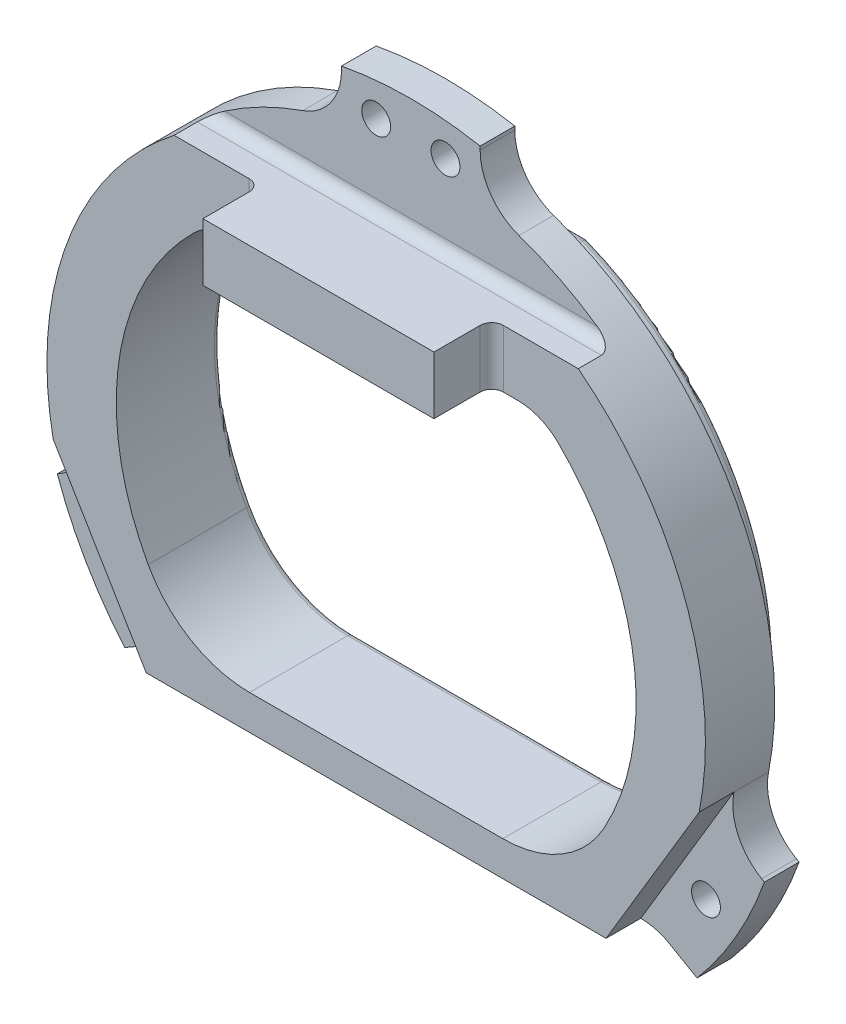
from build123d import *

# Parameters (mm, degrees)
BASE_EXTRUDE_DEPTH                             = 3
BASE_START                                     = -3
BASE_CENTER_FILL_DEPTH                         = 3
HYDRA_CRADDLE_INSERT_DEPTH                     = 3
WEIGHT_RELIEF_DEPTH                            = 46.043730576
WEIGHT_RELIEF_DEPTH_BACK                       = 46.043730576
SKETCH6_R                                      = 1.25
SCREWHOLES_TO_HYDRA_CRADDLE_DEPTH              = 10
FILLET1_R                                      = 10
FILLET2_R                                      = 5
SPACER_BETWEEN_HYDRA_STACK_AND_E_MATCH_C_DEPTH = 3
EMATCH_WIRE_CLEARANCE_CUT_DEPTH                = 46.540505752
EMATCH_WIRE_CLEARANCE_CUT_DEPTH_BACK           = 3
SKETCH9_W                                      = 20
SKETCH9_H                                      = 5
ALIGNMENT_PEG_WITH_BLAST_SHIELD_DEPTH          = 5
FILLET3_R                                      = 1
FILLET4_R                                      = 0.5


with BuildPart() as part:
    # Sketch1 → BASE EXTRUDE (new body)
    with BuildSketch(Plane.XY.offset(25)):
        with BuildLine():
            Line((0, 19.861263432), (6, 19.861263432))
            Line((6, 19.861263432), (6, 24))
            ThreePointArc((6, 24), (6.4, 24.8), (7.28, 24.96))
            ThreePointArc((7.28, 24.96), (25.292757683, 6.022990019), (17.748239349, -19))
            Line((17.748239349, -19), (19.902899824, -19))
            ThreePointArc((19.902899824, -19), (21.19699505, -19.170370869), (22.402899824, -19.669872981))
            Line((22.402899824, -19.669872981), (24.772193743, -21.037785463))
            ThreePointArc((24.772193743, -21.037785463), (28.145825623, -16.25), (30.605353521, -10.934456357))
            Line((30.605353521, -10.934456357), (30.369621377, -10.79835634))
            ThreePointArc((30.369621377, -10.79835634), (28.317417482, -8.536426532), (27.963707738, -5.50282196))
            ThreePointArc((27.963707738, -5.50282196), (24.719171834, 14.184940742), (9.358208955, 26.919768297))
            ThreePointArc((9.358208955, 26.919768297), (6.925140786, 28.74503188), (6, 31.642534665))
            Line((6, 31.642534665), (6, 31.941352507))
            ThreePointArc((6, 31.941352507), (3.012975565, 32.360036747), (0, 32.5))
            ThreePointArc((0, 32.5), (-3.012975565, 32.360036747), (-6, 31.941352507))
            Line((-6, 31.941352507), (-6, 31.642534665))
            ThreePointArc((-6, 31.642534665), (-6.925140786, 28.74503188), (-9.358208955, 26.919768297))
            ThreePointArc((-9.358208955, 26.919768297), (-24.719171834, 14.184940742), (-27.963707738, -5.50282196))
            ThreePointArc((-27.963707738, -5.50282196), (-28.317417482, -8.536426532), (-30.369621377, -10.79835634))
            Line((-30.369621377, -10.79835634), (-30.605353521, -10.934456357))
            ThreePointArc((-30.605353521, -10.934456357), (-28.145825623, -16.25), (-24.772193743, -21.037785463))
            Line((-24.772193743, -21.037785463), (-22.402899824, -19.669872981))
            ThreePointArc((-22.402899824, -19.669872981), (-21.19699505, -19.170370869), (-19.902899824, -19))
            Line((-19.902899824, -19), (-17.748239349, -19))
            ThreePointArc((-17.748239349, -19), (-25.292757683, 6.022990019), (-7.28, 24.96))
            ThreePointArc((-7.28, 24.96), (-6.4, 24.8), (-6, 24))
            Line((-6, 24), (-6, 19.861263432))
            Line((-6, 19.861263432), (0, 19.861263432))
        make_face()
    extrude(amount=BASE_EXTRUDE_DEPTH)

    # Sketch3 → BASE CENTER FILL (add)
    with BuildSketch(Plane.XY.offset(28).offset(BASE_START)):
        with BuildLine():
            Line((-17.748239349, -19), (17.748239349, -19))
            ThreePointArc((17.748239349, -19), (0, 26), (-17.748239349, -19))
        make_face()
    extrude(amount=BASE_CENTER_FILL_DEPTH)

    # Sketch4 → HYDRA CRADDLE INSERT (add)
    with BuildSketch(Plane(origin=(0, 0, 25), x_dir=(-1, 0, 0), z_dir=(0, 0, -1))):
        with BuildLine():
            Line((-6.25, 23.763154252), (-9.25, 23.763154252))
            ThreePointArc((-9.25, 23.763154252), (-25.090515447, 4.551487076), (-17.007351352, -19))
            Line((-17.007351352, -19), (17.007351352, -19))
            ThreePointArc((17.007351352, -19), (25.090515447, 4.551487076), (9.25, 23.763154252))
            Line((9.25, 23.763154252), (6.25, 23.763154252))
            Line((6.25, 23.763154252), (6.25, 19.5))
            Line((6.25, 19.5), (-6.25, 19.5))
            Line((-6.25, 19.5), (-6.25, 23.763154252))
        make_face()
    extrude(amount=HYDRA_CRADDLE_INSERT_DEPTH)

    # Sketch5 → WEIGHT RELIEF (cut, two sides: drawn at the far end of the back side and taken through both)
    with BuildSketch(Plane(origin=(0, 0, 22), x_dir=(-1, 0, 0), z_dir=(0, 0, -1)).offset(-WEIGHT_RELIEF_DEPTH_BACK)):
        with BuildLine():
            Line((-14.142135624, 17.5), (14.142135624, 17.5))
            ThreePointArc((14.142135624, 17.5), (22.471855433, 1.125039286), (15.81929202, -16))
            Line((15.81929202, -16), (-15.81929202, -16))
            ThreePointArc((-15.81929202, -16), (-22.471855433, 1.125039286), (-14.142135624, 17.5))
        make_face()
    extrude(amount=WEIGHT_RELIEF_DEPTH + WEIGHT_RELIEF_DEPTH_BACK, mode=Mode.SUBTRACT)

    # Sketch6 → SCREWHOLES TO HYDRA CRADDLE (cut)
    with BuildSketch(Plane(origin=(0, 0, 25), x_dir=(-1, 0, 0), z_dir=(0, 0, -1))):
        with Locations((-25.547749412, -14.75)):
            Circle(SKETCH6_R)
        with Locations((25.547749412, -14.75)):
            Circle(SKETCH6_R)
        with Locations((-3, 29.5)):
            Circle(SKETCH6_R)
        with Locations((3, 29.5)):
            Circle(SKETCH6_R)
    extrude(amount=-SCREWHOLES_TO_HYDRA_CRADDLE_DEPTH, mode=Mode.SUBTRACT)

    # Fillet1
    fillet1_edges = [part.edges().sort_by_distance(p)[0] for p in [
        (15.81929202, -16, 25),
        (-15.81929202, -16, 25),
    ]]
    fillet(fillet1_edges, radius=FILLET1_R)

    # Fillet2
    fillet2_edges = [part.edges().sort_by_distance(p)[0] for p in [
        (14.142135624, 17.5, 25),
        (-14.142135624, 17.5, 25),
    ]]
    fillet(fillet2_edges, radius=FILLET2_R)

    # Sketch7 → SPACER BETWEEN HYDRA STACK AND E-MATCH CRADDLES (add)
    with BuildSketch(Plane.XY.offset(28)):
        with BuildLine():
            Line((-9.358208955, 26.919768297), (9.358208955, 26.919768297))
            ThreePointArc((9.358208955, 26.919768297), (24.719171834, 14.184940742), (27.963707738, -5.50282196))
            Line((27.963707738, -5.50282196), (19.902899824, -19))
            Line((19.902899824, -19), (-19.902899824, -19))
            Line((-19.902899824, -19), (-27.963707738, -5.50282196))
            ThreePointArc((-27.963707738, -5.50282196), (-24.719171834, 14.184940742), (-9.358208955, 26.919768297))
        make_face()
        with BuildLine():
            Line((10.9658561, -16), (-10.9658561, -16))
            ThreePointArc((-10.9658561, -16), (-16.064875613, -14.602325267), (-19.73854098, -10.8))
            ThreePointArc((-19.73854098, -10.8), (-22.255771186, 3.306153192), (-15.746719775, 16.071428571))
            ThreePointArc((-15.746719775, 16.071428571), (-14.137271079, 17.129100499), (-12.247448714, 17.5))
            Line((-12.247448714, 17.5), (12.247448714, 17.5))
            ThreePointArc((12.247448714, 17.5), (14.137271079, 17.129100499), (15.746719775, 16.071428571))
            ThreePointArc((15.746719775, 16.071428571), (22.255771186, 3.306153192), (19.73854098, -10.8))
            ThreePointArc((19.73854098, -10.8), (16.064875613, -14.602325267), (10.9658561, -16))
        make_face(mode=Mode.SUBTRACT)
    extrude(amount=SPACER_BETWEEN_HYDRA_STACK_AND_E_MATCH_C_DEPTH)

    # Sketch8 → EMATCH WIRE CLEARANCE CUT (cut, two sides: drawn at the far end of the back side and taken through both)
    with BuildSketch(Plane.XY.offset(31).offset(-EMATCH_WIRE_CLEARANCE_CUT_DEPTH_BACK)):
        with BuildLine():
            Line((-17.492855685, 22.5), (17.492855685, 22.5))
            ThreePointArc((17.492855685, 22.5), (13.606193664, 25.042393935), (9.358208955, 26.919768297))
            Line((9.358208955, 26.919768297), (-9.358208955, 26.919768297))
            ThreePointArc((-9.358208955, 26.919768297), (-13.606193664, 25.042393935), (-17.492855685, 22.5))
        make_face()
    extrude(amount=EMATCH_WIRE_CLEARANCE_CUT_DEPTH + EMATCH_WIRE_CLEARANCE_CUT_DEPTH_BACK, mode=Mode.SUBTRACT)

    # Sketch9 → ALIGNMENT PEG WITH BLAST SHIELD (add)
    with BuildSketch(Plane.XY.offset(31)):
        with Locations((0, 20)):
            Rectangle(SKETCH9_W, SKETCH9_H)
    extrude(amount=ALIGNMENT_PEG_WITH_BLAST_SHIELD_DEPTH)

    # Fillet3
    fillet3_edges = [part.edges().sort_by_distance(p)[0] for p in [
        (0, 22.5, 28),
        (-10, 20, 31),
        (10, 20, 31),
    ]]
    fillet(fillet3_edges, radius=FILLET3_R)

    # Fillet4
    fillet4_edges = [part.edges().sort_by_distance(p)[0] for p in [
        (7.75, 23.763154252, 22),
        (6.25, 23.763154252, 23.5),
        (25.090515447, 4.551487076, 25),
        (9.25, 23.763154252, 23.5),
        (-25.090515447, 4.551487076, 25),
        (-7.75, 23.763154252, 22),
        (-9.25, 23.763154252, 23.5),
        (-6.25, 21.631577126, 22),
        (-6.25, 23.763154252, 23.5),
        (0, 19.5, 22),
        (6.25, 21.631577126, 22),
        (6.25, 19.5, 23.5),
        (25.090515447, 4.551487076, 22),
        (0, -19, 22),
        (-25.090515447, 4.551487076, 22),
        (7.75, 23.763154252, 25),
        (6.25, 21.631577126, 25),
        (0, 19.5, 25),
        (-6.25, 21.631577126, 25),
        (-7.75, 23.763154252, 25),
        (-22.255771186, 3.306153192, 22),
        (0, -16, 22),
        (-16.064875613, -14.602325267, 22),
        (16.064875613, -14.602325267, 22),
        (0, 17.5, 22),
        (22.255771186, 3.306153192, 22),
        (-14.137271079, 17.129100499, 22),
        (14.137271079, 17.129100499, 22),
    ]]
    fillet(fillet4_edges, radius=FILLET4_R)


solid = part.part
